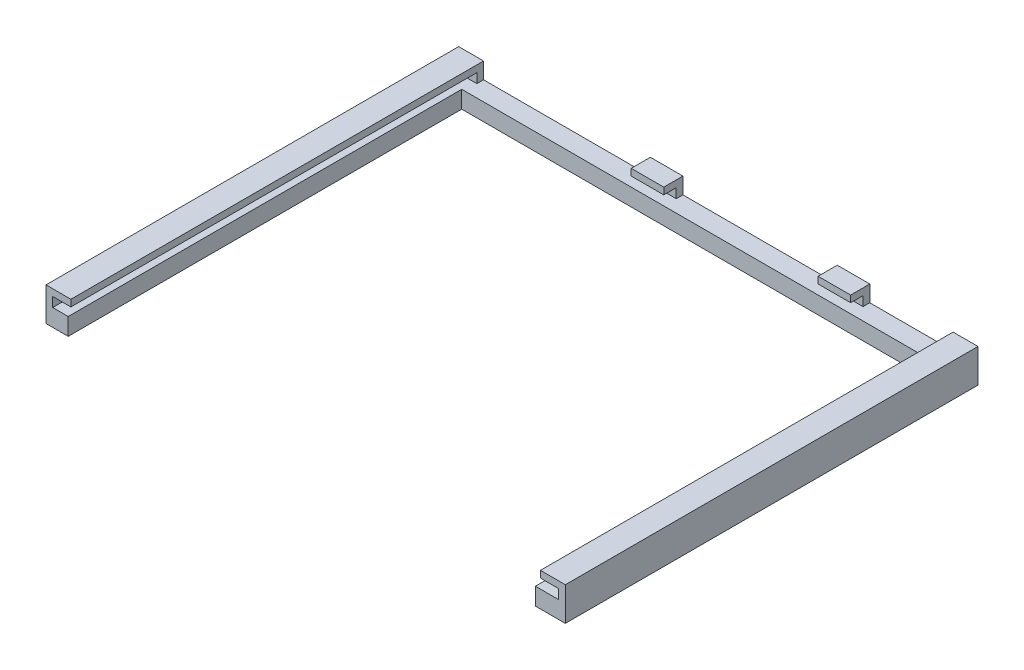
from build123d import *

# Parameters (mm, degrees)
BOSS_EXTRUDE1_DEPTH = 107.75
SKETCH2_W           = 8.5
SKETCH2_H           = 5
BOSS_EXTRUDE2_DEPTH = 4.25
SKETCH3_W           = 8.5
SKETCH3_H           = 2.5
CUT_EXTRUDE1_DEPTH  = 3.25
SKETCH4_W           = 1.75
SKETCH4_H           = 2.5
BOSS_EXTRUDE3_DEPTH = 4.75
SKETCH5_W           = 1.75
SKETCH5_H           = 2.5
BOSS_EXTRUDE4_DEPTH = 4.75
SKETCH7_W           = 121.985175889
SKETCH7_H           = 106.89742867
CUT_EXTRUDE4_DEPTH  = 4.5


with BuildPart() as part:
    # Sketch1 → Boss-Extrude1 (new body)
    with BuildSketch(Plane.XY):
        Polygon((-61.3, -24.208957416), (-61.3, -22.458957416), (-67.8, -22.458957416), (-67.8, -31.208957416), (67.8, -31.208957416), (67.8, -22.458957416), (61.3, -22.458957416), (61.3, -24.208957416), (66.05, -24.208957416), (66.05, -26.708957416), (-66.05, -26.708957416), (-66.05, -24.208957416), align=None)
    extrude(amount=-BOSS_EXTRUDE1_DEPTH)

    # Sketch2 → Boss-Extrude2 (add)
    with BuildSketch(Plane(origin=(0, -26.708957416, 0), x_dir=(1, 0, 0), z_dir=(0, 1, 0))):
        with Locations((-13.5, 105.25)):
            Rectangle(SKETCH2_W, SKETCH2_H)
        with Locations((35.3, 105.25)):
            Rectangle(SKETCH2_W, SKETCH2_H)
    extrude(amount=BOSS_EXTRUDE2_DEPTH)

    # Sketch3 → Cut-Extrude1 (cut)
    with BuildSketch(Plane.XY.offset(-102.75)):
        with Locations((-13.5, -25.458957416)):
            Rectangle(SKETCH3_W, SKETCH3_H)
        with Locations((35.3, -25.458957416)):
            Rectangle(SKETCH3_W, SKETCH3_H)
    extrude(amount=-CUT_EXTRUDE1_DEPTH, mode=Mode.SUBTRACT)

    # Sketch4 → Boss-Extrude3 (add)
    with BuildSketch(Plane.ZY.offset(-66.05)):
        with Locations((-106.875, -25.458957416)):
            Rectangle(SKETCH4_W, SKETCH4_H)
    extrude(amount=BOSS_EXTRUDE3_DEPTH)

    # Sketch5 → Boss-Extrude4 (add)
    with BuildSketch(Plane(origin=(-66.05, 0, 0), x_dir=(0, 0, -1), z_dir=(1, 0, 0))):
        with Locations((106.875, -25.458957416)):
            Rectangle(SKETCH5_W, SKETCH5_H)
    extrude(amount=BOSS_EXTRUDE4_DEPTH)

    # Sketch7 → Cut-Extrude4 (cut)
    with BuildSketch(Plane.XZ.offset(31.208957416)):
        with Locations((-1.007412056, -49.301285665)):
            Rectangle(SKETCH7_W, SKETCH7_H)
    extrude(amount=-CUT_EXTRUDE4_DEPTH, mode=Mode.SUBTRACT)


solid = part.part
